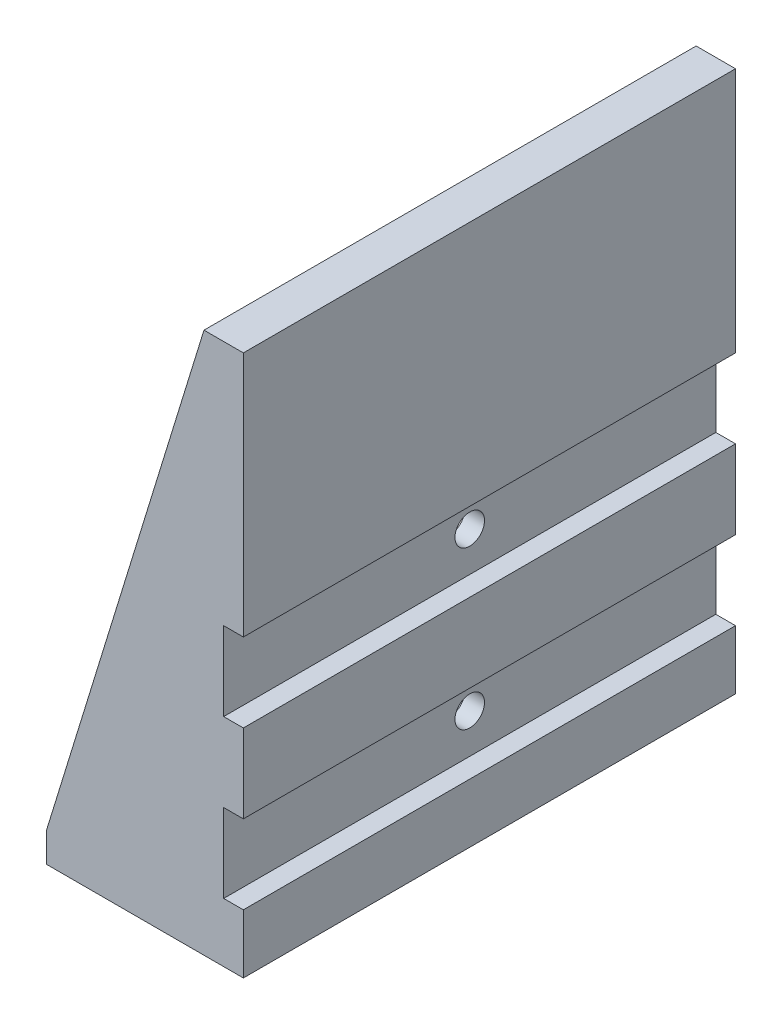
from build123d import *

# Parameters (mm, degrees)
BOSS_EXTRUDE1_DEPTH = 50
SKETCH2_W           = 50
SKETCH2_H           = 8
CUT_EXTRUDE1_DEPTH  = 2
SKETCH4_W           = 45
SKETCH4_H           = 52
CUT_EXTRUDE2_DEPTH  = 16
SKETCH6_R           = 1.5
CUT_EXTRUDE4_DEPTH  = 2
CUT_EXTRUDE_2_DEPTH = 16


with BuildPart() as part:
    # Sketch1 → Boss-Extrude1 (new body)
    with BuildSketch(Plane.XY):
        Polygon((-10, 0), (10, 0), (10, 55), (6, 55), (-10, 3), align=None)
    extrude(amount=BOSS_EXTRUDE1_DEPTH)

    # Sketch2 → Cut-Extrude1 (cut)
    with BuildSketch(Plane(origin=(10, 0, 0), x_dir=(0, 0, -1), z_dir=(1, 0, 0))):
        with Locations((-25, 10)):
            Rectangle(SKETCH2_W, SKETCH2_H)
        with Locations((-25, 26)):
            Rectangle(SKETCH2_W, SKETCH2_H)
    extrude(amount=-CUT_EXTRUDE1_DEPTH, mode=Mode.SUBTRACT)

    # Sketch4 → Cut-Extrude2 (cut)
    with BuildSketch(Plane.ZY.offset(10)):
        with Locations((25, 29)):
            Rectangle(SKETCH4_W, SKETCH4_H)
    extrude(amount=-CUT_EXTRUDE2_DEPTH, mode=Mode.SUBTRACT)

    # Sketch6 → Cut-Extrude4 (cut)
    with BuildSketch(Plane(origin=(8, 0, 0), x_dir=(0, 0, -1), z_dir=(1, 0, 0))):
        with Locations((-25, 26)):
            Circle(SKETCH6_R)
        with Locations((-25, 10)):
            Circle(SKETCH6_R)
    extrude(amount=-CUT_EXTRUDE4_DEPTH, mode=Mode.SUBTRACT)

    # 草图2 → 切除-拉伸2 (cut)
    with BuildSketch(Plane(origin=(0, 3, 0), x_dir=(1, 0, 0), z_dir=(0, 1, 0))):
        with BuildLine():
            Line((-7, -24), (3, -24))
            ThreePointArc((3, -24), (4, -25), (3, -26))
            Line((3, -26), (-7, -26))
            ThreePointArc((-7, -26), (-8, -25), (-7, -24))
        make_face()
    extrude(amount=-CUT_EXTRUDE_2_DEPTH, mode=Mode.SUBTRACT)


solid = part.part
